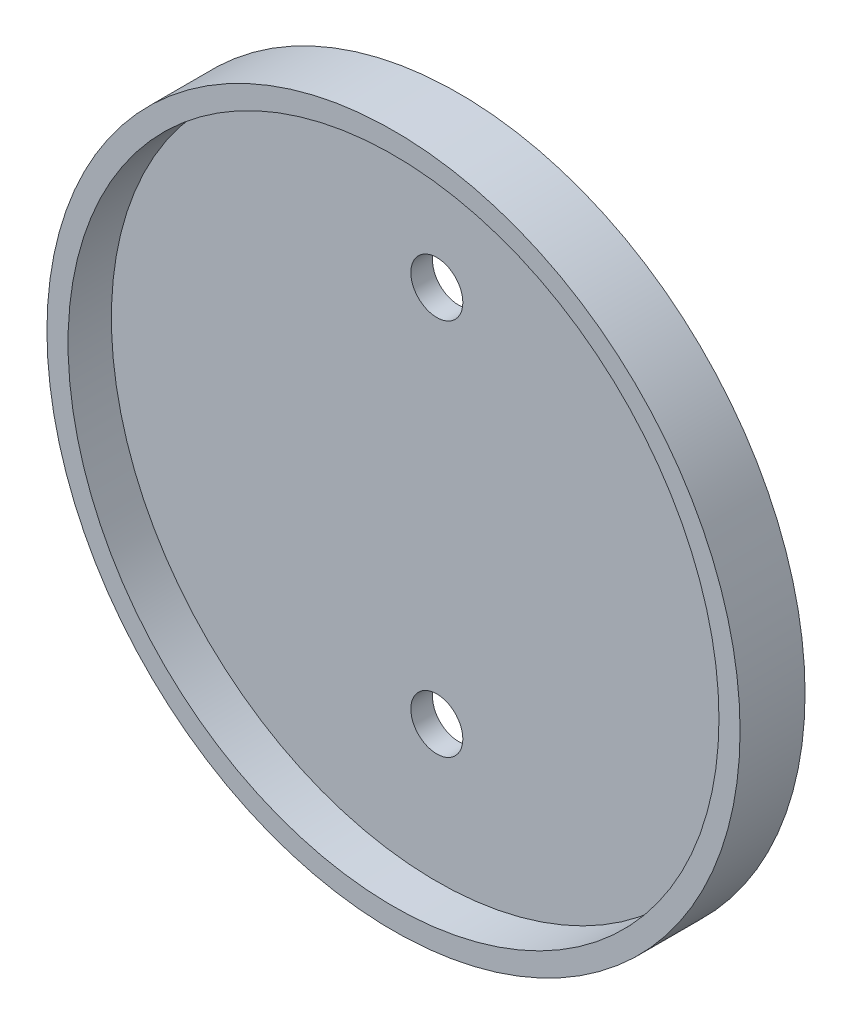
from build123d import *

# Parameters (mm, degrees)
SKETCH1_R            = 32
BOSS_EXTRUDE1_DEPTH  = 0.999998
BOSS_EXTRUDE2_START  = 4
SKETCH2_R            = 32
SKETCH2_R_2          = 30.05
BOSS_EXTRUDE2_DEPTH  = 4
M4_CLEARANCE_HOLE1_D = 4.8


with BuildPart() as part:
    # Sketch1 → Boss-Extrude1 (new, symmetric)
    with BuildSketch(Plane.XY):
        Circle(SKETCH1_R)
    extrude(amount=BOSS_EXTRUDE1_DEPTH, both=True)

    # Sketch2 → Boss-Extrude2 (add)
    with BuildSketch(Plane.XY.offset(0.999998).offset(BOSS_EXTRUDE2_START)):
        Circle(SKETCH2_R)
        Circle(SKETCH2_R_2, mode=Mode.SUBTRACT)
    extrude(amount=-BOSS_EXTRUDE2_DEPTH)

    # M4 Clearance Hole1 (through all)
    with Locations(Plane(origin=(0, 0, -0.999998), x_dir=(-1, 0, 0), z_dir=(0, 0, -1))):
        with Locations((0, 17.4498), (0, -17.4498)):
            Hole(M4_CLEARANCE_HOLE1_D / 2)


solid = part.part
